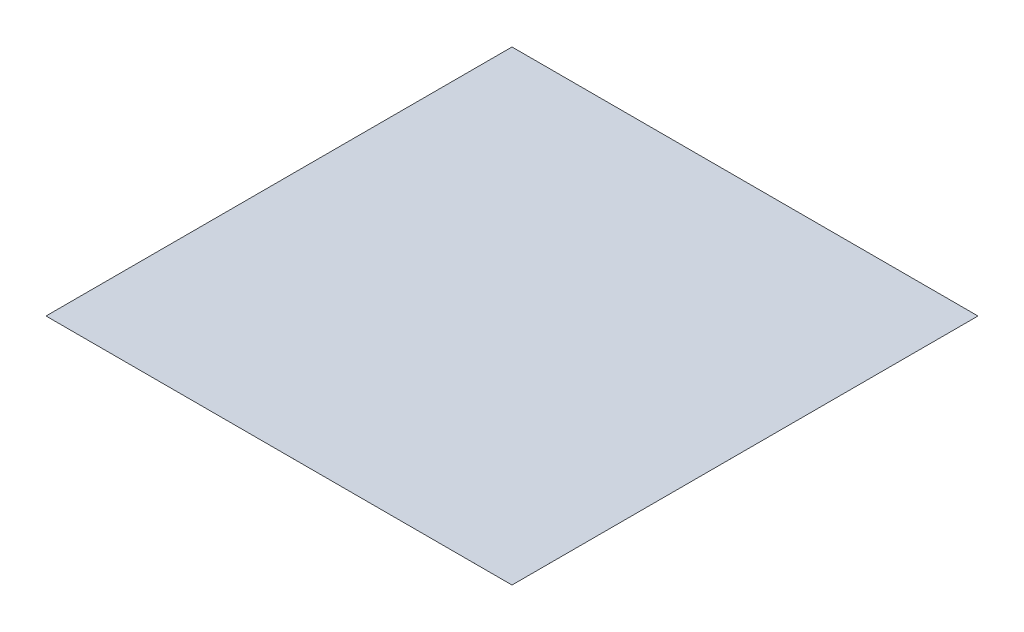
from build123d import *

# Parameters (mm, degrees)
SKETCH_1_W      = 650
SKETCH_1_H      = 650
EXTRUDE_1_DEPTH = 0.001


with BuildPart() as part:
    # 草图1 → 凸台-拉伸1 (new body)
    with BuildSketch(Plane(origin=(0, 0, 0), x_dir=(1, 0, 0), z_dir=(0, 1, 0))):
        Rectangle(SKETCH_1_W, SKETCH_1_H)
    extrude(amount=EXTRUDE_1_DEPTH)


solid = part.part
